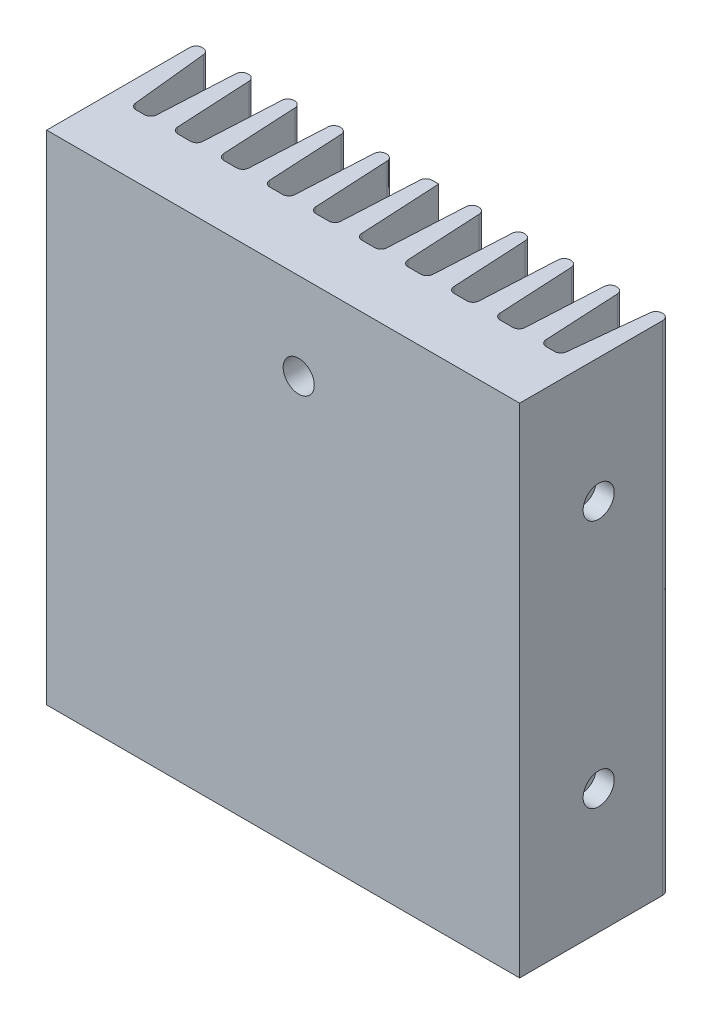
from build123d import *

# Parameters (mm, degrees)
EXTRUDE1_DEPTH            = 40
BOSS_EXTRUDE1_DEPTH       = 40
LPATTERN1_COUNT           = 9
LPATTERN1_PITCH           = 3.7
FILLET1_R                 = 0.5
FILLET2_R                 = 0.5
M3X0_5_TAPPED_HOLE1_D     = 2.5
M3X0_5_TAPPED_HOLE1_DEPTH = 6.5
M3X0_5_TAPPED_HOLE1_TIP   = 0.751075774
M3X0_5_TAPPED_HOLE2_D     = 2.5
M3X0_5_TAPPED_HOLE2_DEPTH = 5
M3X0_5_TAPPED_HOLE2_TIP   = 0.751075774


with BuildPart() as part:
    # Sketch1 → Extrude1 (new body)
    with BuildSketch(Plane(origin=(0, 0, 0), x_dir=(1, 0, 0), z_dir=(0, 1, 0))):
        Polygon((0, 12), (0, 0), (38, 0), (38, 12), (37, 12), (36.264270353, 5), (1.735729647, 5), (1, 12), align=None)
    extrude(amount=EXTRUDE1_DEPTH)

    # Sketch3 → Boss-Extrude1 (add)
    with BuildSketch(Plane(origin=(0, 40, 0), x_dir=(1, 0, 0), z_dir=(0, 1, 0))):
        Polygon((3.333145545, 5), (3.7, 12), (4.7, 12), (5.066854455, 5), align=None)
    boss_extrude1 = extrude(amount=-BOSS_EXTRUDE1_DEPTH)

    # LPattern1: Boss-Extrude1 ×9
    with Locations(*[(i * LPATTERN1_PITCH, 0, 0) for i in range(1, LPATTERN1_COUNT)]):
        add(boss_extrude1)

    # Fillet1
    fillet1_edges = [part.edges().sort_by_distance(p)[0] for p in [
        (34.666854455, 20, -5),
        (32.933145545, 20, -5),
        (1.735729647, 20, -5),
        (36.264270353, 20, -5),
        (5.066854455, 20, -5),
        (3.333145545, 20, -5),
        (8.766854455, 20, -5),
        (7.033145545, 20, -5),
        (12.466854455, 20, -5),
        (10.733145545, 20, -5),
        (16.166854455, 20, -5),
        (14.433145545, 20, -5),
        (19.866854455, 20, -5),
        (18.133145545, 20, -5),
        (23.566854455, 20, -5),
        (21.833145545, 20, -5),
        (27.266854455, 20, -5),
        (25.533145545, 20, -5),
        (30.966854455, 20, -5),
        (29.233145545, 20, -5),
    ]]
    fillet(fillet1_edges, radius=FILLET1_R)

    # Fillet2
    fillet2_edges = [part.edges().sort_by_distance(p)[0] for p in [
        (33.3, 20, -12),
        (34.3, 20, -12),
        (1, 20, -12),
        (37, 20, -12),
        (38, 20, -12),
        (0, 20, -12),
        (3.7, 20, -12),
        (4.7, 20, -12),
        (7.4, 20, -12),
        (8.4, 20, -12),
        (11.1, 20, -12),
        (12.1, 20, -12),
        (14.8, 20, -12),
        (15.8, 20, -12),
        (18.5, 20, -12),
        (22.2, 20, -12),
        (23.2, 20, -12),
        (25.9, 20, -12),
        (26.9, 20, -12),
        (29.6, 20, -12),
        (30.6, 20, -12),
    ]]
    fillet(fillet2_edges, radius=FILLET2_R)

    # M3x0.5 Tapped Hole1
    with Locations(Plane(origin=(38, 0, 0), x_dir=(0, 0, -1), z_dir=(1, 0, 0))):
        with Locations((6.35, 30), (6.35, 10)):
            Hole(M3X0_5_TAPPED_HOLE1_D / 2, depth=M3X0_5_TAPPED_HOLE1_DEPTH)
            with Locations((0, 0, -(M3X0_5_TAPPED_HOLE1_DEPTH + M3X0_5_TAPPED_HOLE1_TIP / 2))):  # 118° drill point
                Cone(0, M3X0_5_TAPPED_HOLE1_D / 2, M3X0_5_TAPPED_HOLE1_TIP, mode=Mode.SUBTRACT)

    # M3x0.5 Tapped Hole2
    with Locations(Plane.XY):
        with Locations((20.25, 33)):
            Hole(M3X0_5_TAPPED_HOLE2_D / 2, depth=M3X0_5_TAPPED_HOLE2_DEPTH)
            with Locations((0, 0, -(M3X0_5_TAPPED_HOLE2_DEPTH + M3X0_5_TAPPED_HOLE2_TIP / 2))):  # 118° drill point
                Cone(0, M3X0_5_TAPPED_HOLE2_D / 2, M3X0_5_TAPPED_HOLE2_TIP, mode=Mode.SUBTRACT)


solid = part.part
